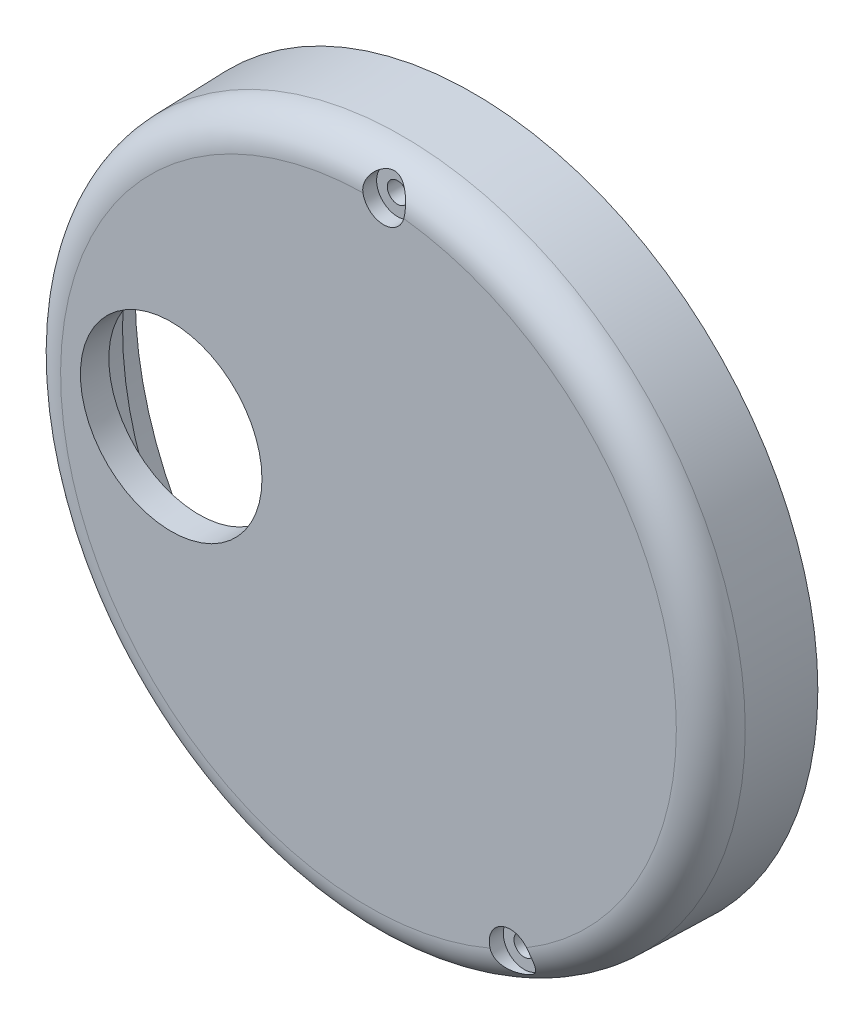
from build123d import *

# Parameters (mm, degrees)
SKETCH2_R                     = 49.197422353
BOSS_EXTRUDE1_DEPTH           = 9
BOSS_EXTRUDE1_TAPER           = 1.5
BOSS_EXTRUDE1_OTHER_WAY_DEPTH = 6
BOSS_EXTRUDE1_OTHER_WAY_TAPER = -1.5
SHELL1_T                      = -4
FILLET1_R                     = 5
SKETCH6_R                     = 13
WIREHOLES_DEPTH               = 10
WIREHOLES_DRAFT               = -1
SKETCH7_R                     = 48.404537882
INSIDELAYER_DEPTH             = 5
INSIDELAYER_DRAFT             = -1
SKETCH8_R                     = 1.500272091
NAIL_DEPTH                    = 10
NAIL_DRAFT                    = -1
SKETCH8_R_2                   = 1.501577836
NAIL_PROFILE_2_DEPTH          = 10
NAIL_PROFILE_2_DRAFT          = -1
SKETCH9_R                     = 3
NAILHEAD_DEPTH                = 2


with BuildPart() as part:
    # Sketch2 → Boss-Extrude1 (new body)
    with BuildSketch(Plane.XY.offset(-134.795498858)):
        with Locations((-8.948, 38.989)):
            Circle(SKETCH2_R)
    extrude(amount=BOSS_EXTRUDE1_DEPTH, taper=BOSS_EXTRUDE1_TAPER)

    # Sketch2 → Boss-Extrude1 other way (add)
    with BuildSketch(Plane.XY.offset(-134.795498858)):
        with Locations((-8.948, 38.989)):
            Circle(SKETCH2_R)
    extrude(amount=-BOSS_EXTRUDE1_OTHER_WAY_DEPTH, taper=BOSS_EXTRUDE1_OTHER_WAY_TAPER)

    # Shell1
    shell1_openings = [part.faces().sort_by_distance(p)[0] for p in [
        (-8.948, 38.989, -140.795498858),
    ]]
    offset(amount=SHELL1_T, openings=shell1_openings, kind=Kind.INTERSECTION)

    # Fillet1
    fillet1_edges = [part.edges().sort_by_distance(p)[0] for p in [
        (-57.909749059, 38.989, -125.795498858),
    ]]
    fillet(fillet1_edges, radius=FILLET1_R)


with BuildPart() as wireholes_tool:
    # Sketch6 → wireHoles (with draft: the straight prism first)
    with BuildSketch(Plane.XY.offset(-125.795498858)):
        with Locations((-37.201803, 40.335557149)):
            Circle(SKETCH6_R)
    extrude(amount=-WIREHOLES_DEPTH)
    # wireHoles: the draft: its side faces are tilted about the plane it starts from
    wireholes_sides = [wireholes_tool.faces().sort_by_distance(p)[0] for p in [
        (-50.201803, 40.335557149, -130.795498858),
    ]]
    draft(wireholes_sides, Plane.XY.offset(-125.795498858), WIREHOLES_DRAFT)


with BuildPart() as part_1:
    add(part.part)

    # wireHoles: cut by wireholes_tool
    add(wireholes_tool.part, mode=Mode.SUBTRACT)


with BuildPart() as insidelayer_tool:
    # Sketch7 → insideLayer (with draft: the straight prism first)
    with BuildSketch(Plane(origin=(0, 0, -140.795498858), x_dir=(-1, 0, 0), z_dir=(0, 0, -1))):
        with Locations((8.948, 38.989)):
            Circle(SKETCH7_R)
    extrude(amount=-INSIDELAYER_DEPTH)
    # insideLayer: the draft: its side faces are tilted about the plane it starts from
    insidelayer_sides = [insidelayer_tool.faces().sort_by_distance(p)[0] for p in [
        (39.456537882, 38.989, -138.295498858),
    ]]
    draft(insidelayer_sides, Plane(origin=(0, 0, -140.795498858), x_dir=(-1, 0, 0), z_dir=(0, 0, -1)), INSIDELAYER_DRAFT)


with BuildPart() as part_2:
    add(part_1.part)

    # insideLayer: cut by insidelayer_tool
    add(insidelayer_tool.part, mode=Mode.SUBTRACT)


with BuildPart() as nail_tool:
    # Sketch8 → nail (with draft: the straight prism first)
    with BuildSketch(Plane.XY.offset(-125.795498858)):
        with Locations((11.351812063, -0.720065293)):
            Circle(SKETCH8_R)
    extrude(amount=-NAIL_DEPTH)
    # nail: the draft: its side faces are tilted about the plane it starts from
    nail_sides = [nail_tool.faces().sort_by_distance(p)[0] for p in [
        (9.851539971, -0.720065293, -130.795498858),
    ]]
    draft(nail_sides, Plane.XY.offset(-125.795498858), NAIL_DRAFT)


with BuildPart() as part_3:
    add(part_2.part)

    # nail: cut by nail_tool
    add(nail_tool.part, mode=Mode.SUBTRACT)


with BuildPart() as nail_profile_2_tool:
    # Sketch8 → nail profile 2 (with draft: the straight prism first)
    with BuildSketch(Plane.XY.offset(-125.795498858)):
        with Locations((-6.787419008, 83.581267699)):
            Circle(SKETCH8_R_2)
    extrude(amount=-NAIL_PROFILE_2_DEPTH)
    # nail profile 2: the draft: its side faces are tilted about the plane it starts from
    nail_profile_2_sides = [nail_profile_2_tool.faces().sort_by_distance(p)[0] for p in [
        (-8.288996843, 83.581267699, -130.795498858),
    ]]
    draft(nail_profile_2_sides, Plane.XY.offset(-125.795498858), NAIL_PROFILE_2_DRAFT)


with BuildPart() as part_4:
    add(part_3.part)

    # nail profile 2: cut by nail_profile_2_tool
    add(nail_profile_2_tool.part, mode=Mode.SUBTRACT)

    # Sketch9 → nailHead (cut)
    with BuildSketch(Plane.XY.offset(-125.795498858)):
        with Locations((-6.787419008, 83.581267699)):
            Circle(SKETCH9_R)
        with Locations((11.351812063, -0.720065293)):
            Circle(SKETCH9_R)
    extrude(amount=-NAILHEAD_DEPTH, mode=Mode.SUBTRACT)


solid = part_4.part
